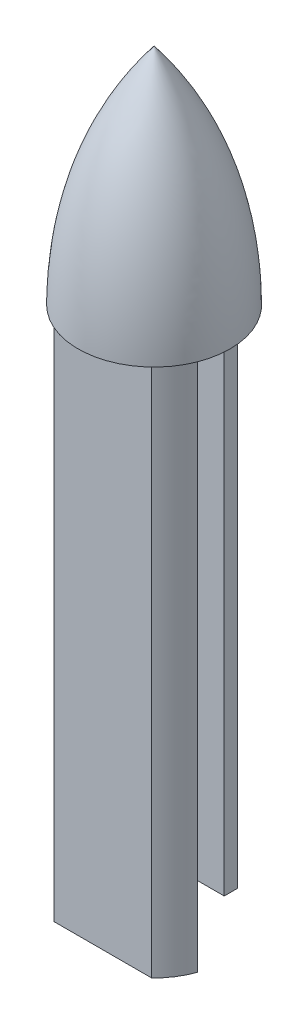
from build123d import *

# Parameters (mm, degrees)
SKETCH3_R           = 25.2
BOSS_EXTRUDE1_DEPTH = 190
CUT_EXTRUDE1_START  = -190
CUT_EXTRUDE1_DEPTH  = 190


with BuildPart() as part:
    # Sketch2 → Revolve1 (revolve)
    with BuildSketch(Plane.XY):
        with BuildLine():
            Line((0, 0), (0, 80))
            add(Edge.make_bspline(
                [(0, 80), (26.841301525, 45.581737531), (27.1, 0)],
                knots=[0, 0, 0, 1, 1, 1], degree=2))
            Line((27.1, 0), (0, 0))
        make_face()
    revolve(axis=Axis((0, 0, 0), (0, 1, 0)))

    # Sketch3 → Boss-Extrude1 (add)
    with BuildSketch(Plane.XZ):
        with Locations(Location((0, 0, 0), (0, 0, 270))):
            Circle(SKETCH3_R)
    extrude(amount=BOSS_EXTRUDE1_DEPTH)

    # Sketch4 → Cut-Extrude1 (cut)
    with BuildSketch(Plane.XZ.offset(190).offset(CUT_EXTRUDE1_START)):
        with BuildLine():
            Line((-23.811289339, -8.25), (0, -8.25))
            Line((0, -8.25), (23.811289339, -8.25))
            ThreePointArc((23.811289339, -8.25), (24.850397294, -4.183031715), (25.2, 0))
            ThreePointArc((25.2, 0), (24.850397294, 4.183031715), (23.811289339, 8.25))
            Line((23.811289339, 8.25), (-23.811289339, 8.25))
            ThreePointArc((-23.811289339, 8.25), (-25.2, 0), (-23.811289339, -8.25))
        make_face()
        with BuildLine():
            Line((0, -20), (0, -8.25))
            Line((0, -8.25), (-23.811289339, -8.25))
            ThreePointArc((-23.811289339, -8.25), (-16.588095085, -18.97037431), (-5, -24.698987834))
            Line((-5, -24.698987834), (-5, -20))
            Line((-5, -20), (0, -20))
        make_face()
        with BuildLine():
            Line((23.811289339, -8.25), (0, -8.25))
            Line((0, -8.25), (0, -20))
            Line((0, -20), (5, -20))
            Line((5, -20), (5, -24.698987834))
            ThreePointArc((5, -24.698987834), (16.588095085, -18.97037431), (23.811289339, -8.25))
        make_face()
        with BuildLine():
            ThreePointArc((17.37749982, 18.25), (0, 25.2), (-17.37749982, 18.25))
            Line((-17.37749982, 18.25), (17.37749982, 18.25))
        make_face()
    extrude(amount=CUT_EXTRUDE1_DEPTH, mode=Mode.SUBTRACT)


solid = part.part
